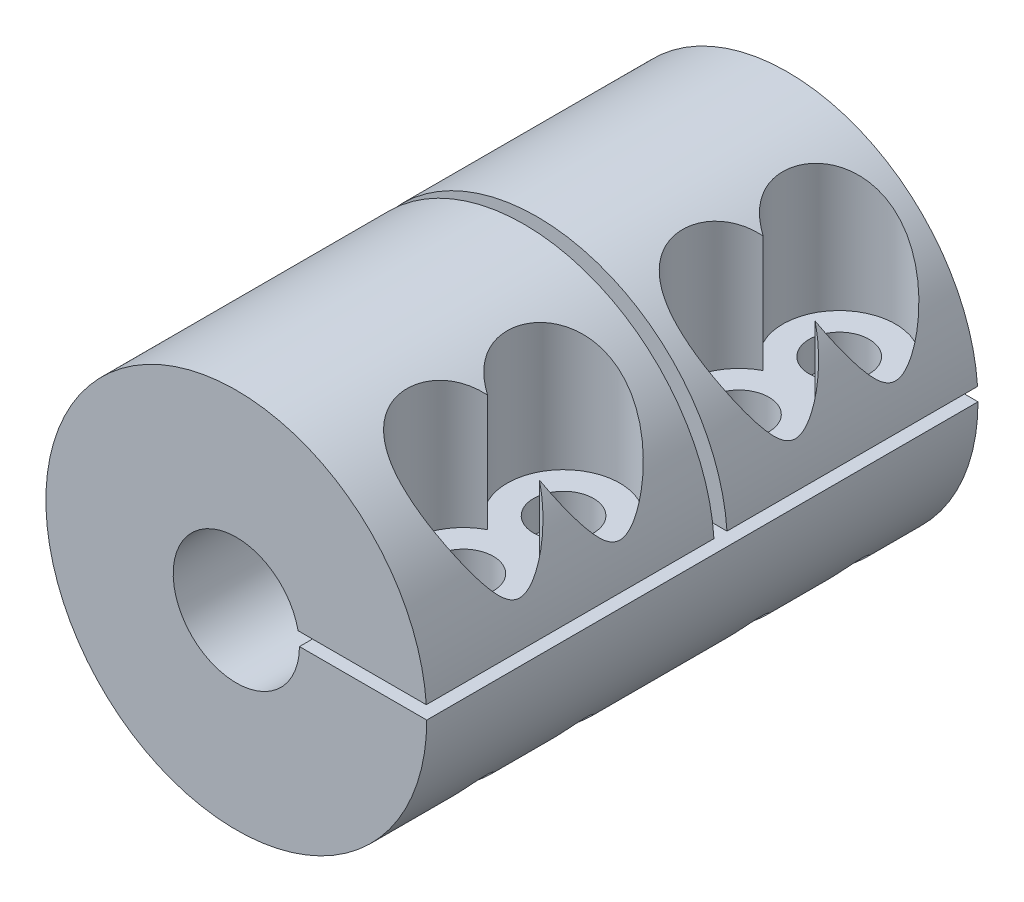
from build123d import *

# Parameters (mm, degrees)
SKETCH4_W                                      = 24.13
SKETCH4_H                                      = 0.8255
CUT_EXTRUDE1_DEPTH                             = 49.057945385
SKETCH5_W                                      = 34.925
SKETCH5_H                                      = 0.8255
CUT_EXTRUDE2_DEPTH                             = 49.057945385
F_6_32_TAPPED_HOLE1_AT_2_COUNT                 = 2
F_6_32_TAPPED_HOLE1_AT_2_PITCH                 = 6.35
F_6_32_TAPPED_HOLE1_AT_3_COUNT                 = 2
F_6_32_TAPPED_HOLE1_AT_3_PITCH                 = 17.4625
F_6_32_TAPPED_HOLE1_AT_4_COUNT                 = 2
F_6_32_TAPPED_HOLE1_AT_4_PITCH                 = 23.8125
CBORE_FOR_6_SOCKET_HEAD_CAP_SCREW1_D           = 3.7973
CBORE_FOR_6_SOCKET_HEAD_CAP_SCREW1_DEPTH       = 11.8745
CBORE_FOR_6_SOCKET_HEAD_CAP_SCREW1_CBORE_D     = 7.14502
CBORE_FOR_6_SOCKET_HEAD_CAP_SCREW1_CBORE_DEPTH = 9.8552


with BuildPart() as part:
    # Sketch1 → Revolve1 (revolve)
    with BuildSketch(Plane(origin=(0, 0, 0), x_dir=(1, 0, 0), z_dir=(0, 1, 0))):
        Polygon((3.175, 44.927025994), (3.175, 29.052025994), (4, 29.052025994), (4, 10.002025994), (12.065, 10.002025994), (12.065, 44.927025994), align=None)
    revolve(axis=Axis((0, 0, 0), (0, 0, -1)))

    # Sketch4 → Cut-Extrude1 (cut, through all)
    with BuildSketch(Plane(origin=(0, 0, 0), x_dir=(1, 0, 0), z_dir=(0, 1, 0))):
        with Locations((0, 28.639275994)):
            Rectangle(SKETCH4_W, SKETCH4_H)
    extrude(amount=CUT_EXTRUDE1_DEPTH, mode=Mode.SUBTRACT)

    # Sketch5 → Cut-Extrude2 (cut, through all)
    with BuildSketch(Plane(origin=(0, 0, 0), x_dir=(0, 0, -1), z_dir=(1, 0, 0))):
        with Locations((27.464525994, 0.41275)):
            Rectangle(SKETCH5_W, SKETCH5_H)
    extrude(amount=CUT_EXTRUDE2_DEPTH, mode=Mode.SUBTRACT)

    # Sketch6 → #6-32 Tapped Hole1 (revolve, cut)
    with BuildSketch(Plane(origin=(8.0325, 0, -16.352025994), x_dir=(0, 0, 1), z_dir=(1, 0, 0))):
        Polygon((0, 0), (0, 11.98869403), (1.35255, 11.176), (1.35255, 0), align=None)
    f_6_32_tapped_hole1 = revolve(axis=Axis((8.0325, 6.35, -16.352025994), (0, -1, 0)), mode=Mode.SUBTRACT)

    # #6-32 Tapped Hole1 at 2: #6-32 Tapped Hole1 ×2
    with Locations(*[(0, 0, -i * F_6_32_TAPPED_HOLE1_AT_2_PITCH) for i in range(1, F_6_32_TAPPED_HOLE1_AT_2_COUNT)]):
        add(f_6_32_tapped_hole1, mode=Mode.SUBTRACT)

    # #6-32 Tapped Hole1 at 3: #6-32 Tapped Hole1 ×2
    with Locations(*[(0, 0, -i * F_6_32_TAPPED_HOLE1_AT_3_PITCH) for i in range(1, F_6_32_TAPPED_HOLE1_AT_3_COUNT)]):
        add(f_6_32_tapped_hole1, mode=Mode.SUBTRACT)

    # #6-32 Tapped Hole1 at 4: #6-32 Tapped Hole1 ×2
    with Locations(*[(0, 0, -i * F_6_32_TAPPED_HOLE1_AT_4_PITCH) for i in range(1, F_6_32_TAPPED_HOLE1_AT_4_COUNT)]):
        add(f_6_32_tapped_hole1, mode=Mode.SUBTRACT)

    # CBORE for #6 Socket Head Cap Screw1
    with Locations(Plane(origin=(0, 12.7, 0), x_dir=(-1, 0, 0), z_dir=(0, 1, 0))):
        with Locations((-8.0325, -16.352025994), (-8.0325, -22.702025994), (-8.0325, -33.814525994), (-8.0325, -40.164525994)):
            CounterBoreHole(CBORE_FOR_6_SOCKET_HEAD_CAP_SCREW1_D / 2, CBORE_FOR_6_SOCKET_HEAD_CAP_SCREW1_CBORE_D / 2, CBORE_FOR_6_SOCKET_HEAD_CAP_SCREW1_CBORE_DEPTH, depth=CBORE_FOR_6_SOCKET_HEAD_CAP_SCREW1_DEPTH)


solid = part.part
